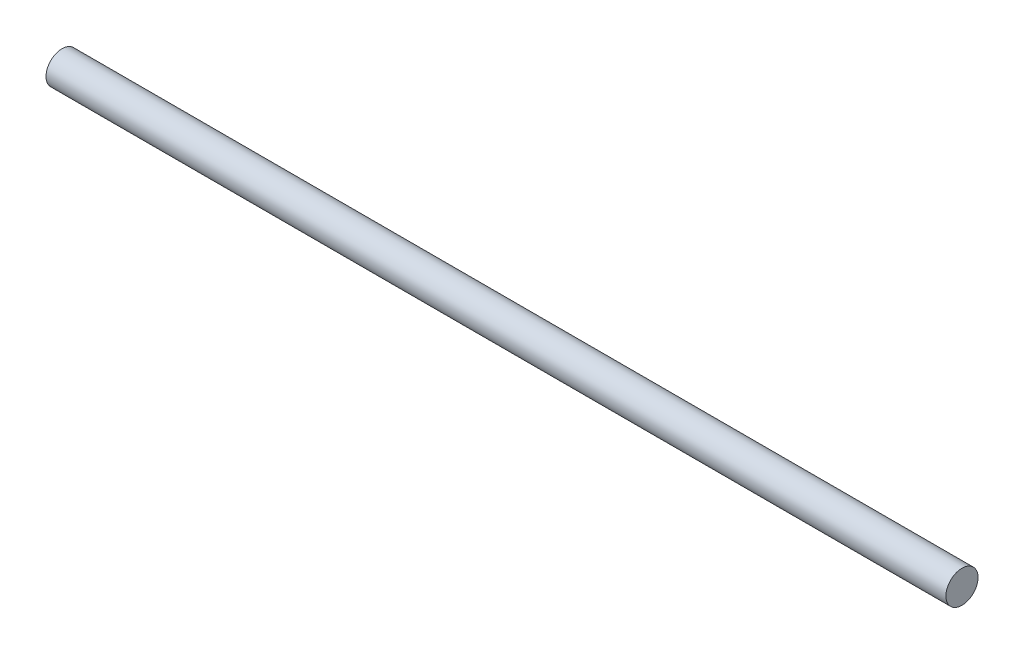
from build123d import *

# Parameters (mm, degrees)
ESQUISSE1_W = 224
ESQUISSE1_H = 4


with BuildPart() as part:
    # Esquisse1 → Révolution1 (revolve)
    with BuildSketch(Plane.XY, mode=Mode.PRIVATE) as r_volution1_sk:
        Rectangle(ESQUISSE1_W, ESQUISSE1_H)
    revolve(r_volution1_sk.sketch.rotate(Axis((-112, -2, 0), (1, 0, 0)), 90), axis=Axis((-112, -2, 0), (1, 0, 0)))


solid = part.part
